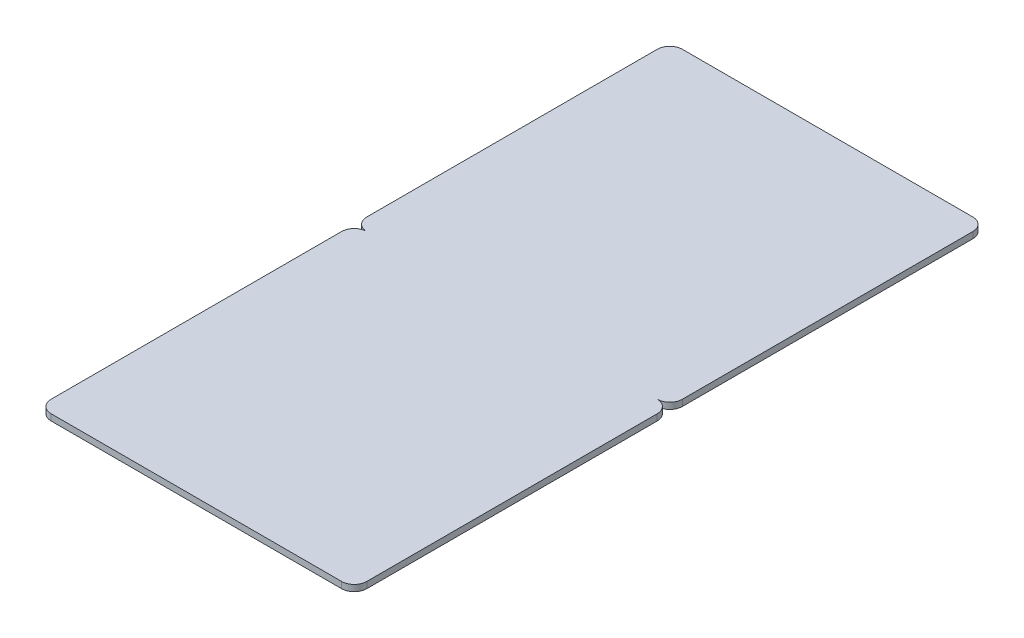
from build123d import *

# Parameters (mm, degrees)
EXTRUDE_1_DEPTH          = 0.5
PATTERN_CIRCULAR_1_COUNT = 2


with BuildPart() as part:
    # 草图1 → 凸台-拉伸1 (new body)
    with BuildSketch(Plane(origin=(0, 0, 0), x_dir=(1, 0, 0), z_dir=(0, 1, 0))):
        with BuildLine():
            Line((-11.5, 0), (11.5, 0))
            ThreePointArc((11.5, 0), (12.207106781, 0.292893219), (12.5, 1))
            Line((12.5, 1), (12.5, 24))
            ThreePointArc((12.5, 24), (12.207106781, 24.707106781), (11.5, 25))
            Line((11.5, 25), (-11.5, 25))
            ThreePointArc((-11.5, 25), (-12.207106781, 24.707106781), (-12.5, 24))
            Line((-12.5, 24), (-12.5, 1))
            ThreePointArc((-12.5, 1), (-12.207106781, 0.292893219), (-11.5, 0))
        make_face()
    extrude(amount=EXTRUDE_1_DEPTH)


with BuildPart() as pattern_circular_1_1:
    # 阵列(圆周)1: pattern copy
    add(part.part.rotate(Axis((0, 0, 0), (0, 1, 0)), 1 * 360 / PATTERN_CIRCULAR_1_COUNT))


with BuildPart() as part_1:
    add(part.part)

    # Combine 1: union 阵列(圆周)1_1
    add(pattern_circular_1_1.part)


solid = part_1.part
